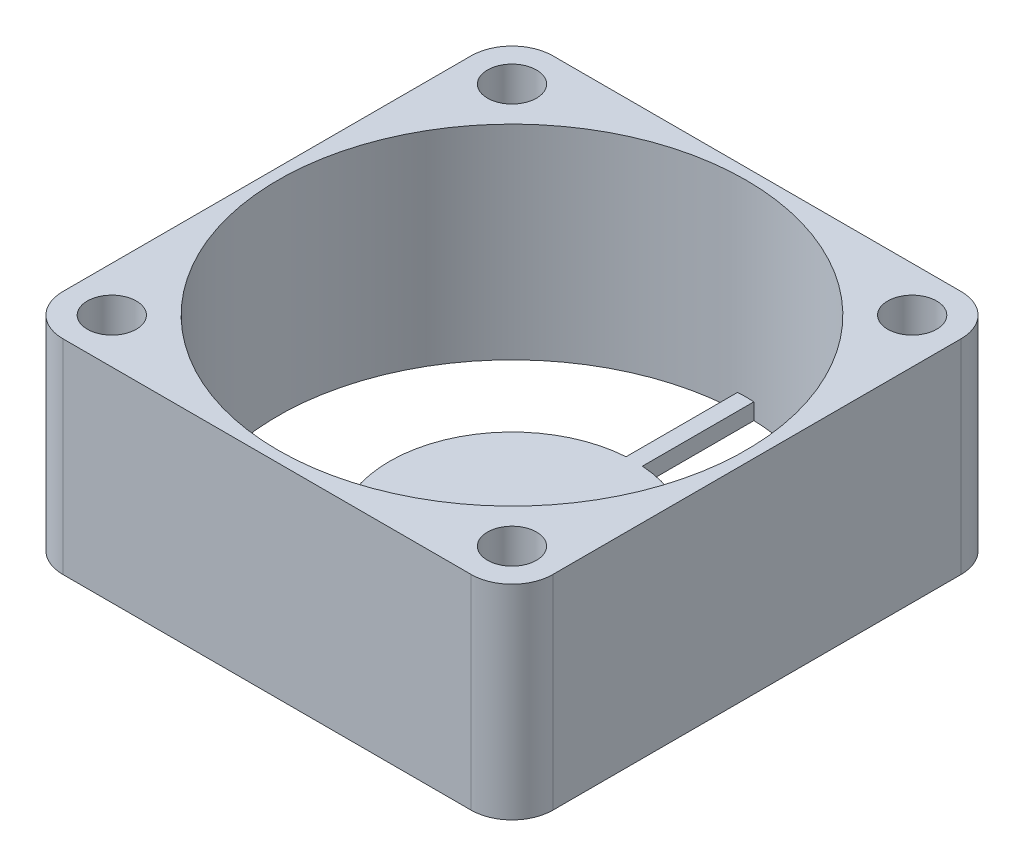
from build123d import *

# Parameters (mm, degrees)
SKETCH5_W           = 30
SKETCH5_H           = 30
SKETCH5_R           = 14.324116139
SKETCH5_R_2         = 1.5
BOSS_EXTRUDE1_DEPTH = 12.5
FILLET1_R           = 2.5
SKETCH6_R           = 7.5
BOSS_EXTRUDE2_DEPTH = 1


with BuildPart() as part:
    # Sketch5 → Boss-Extrude1 (new body)
    with BuildSketch(Plane(origin=(0, 0, 0), x_dir=(1, 0, 0), z_dir=(0, 1, 0))):
        Rectangle(SKETCH5_W, SKETCH5_H)
        with Locations(Location((0, 0, 0), (0, 0, 270))):
            Circle(SKETCH5_R, mode=Mode.SUBTRACT)
        with Locations(Location((-12.25, -12.25, 0), (0, 0, 270))):
            Circle(SKETCH5_R_2, mode=Mode.SUBTRACT)
        with Locations(Location((-12.25, 12.25, 0), (0, 0, 270))):
            Circle(SKETCH5_R_2, mode=Mode.SUBTRACT)
        with Locations(Location((12.25, -12.25, 0), (0, 0, 270))):
            Circle(SKETCH5_R_2, mode=Mode.SUBTRACT)
        with Locations(Location((12.25, 12.25, 0), (0, 0, 270))):
            Circle(SKETCH5_R_2, mode=Mode.SUBTRACT)
    extrude(amount=BOSS_EXTRUDE1_DEPTH)

    # Fillet1
    fillet1_edges = [part.edges().sort_by_distance(p)[0] for p in [
        (15, 6.25, 15),
        (-15, 6.25, 15),
        (-15, 6.25, -15),
        (15, 6.25, -15),
    ]]
    fillet(fillet1_edges, radius=FILLET1_R)


with BuildPart() as body_2:
    # Sketch6 → Boss-Extrude2 (new body)
    with BuildSketch(Plane(origin=(0, 0, 0), x_dir=(1, 0, 0), z_dir=(0, 1, 0))):
        Circle(SKETCH6_R)
        with BuildLine():
            ThreePointArc((-0.5, 7.483314774), (-0.25013916, 7.495827533), (0, 7.5))
            Line((0, 7.5), (0, 14.324116139))
            ThreePointArc((0, 14.324116139), (-0.250038097, 14.321933672), (-0.5, 14.315386937))
            Line((-0.5, 14.315386937), (-0.5, 7.483314774))
        make_face()
        with BuildLine():
            ThreePointArc((0, 7.5), (0.25013916, 7.495827533), (0.5, 7.483314774))
            Line((0.5, 7.483314774), (0.5, 14.315386937))
            ThreePointArc((0.5, 14.315386937), (0.250038097, 14.321933672), (0, 14.324116139))
            Line((0, 14.324116139), (0, 7.5))
        make_face()
        with BuildLine():
            Line((12.647488753, -6.724680767), (6.730740698, -3.308644685))
            ThreePointArc((6.730740698, -3.308644685), (6.495190528, -3.75), (6.230740698, -4.174670089))
            Line((6.230740698, -4.174670089), (12.147488753, -7.590706171))
            ThreePointArc((12.147488753, -7.590706171), (12.405048463, -7.16205807), (12.647488753, -6.724680767))
        make_face()
        with BuildLine():
            ThreePointArc((-6.230740698, -4.174670089), (-6.495190528, -3.75), (-6.730740698, -3.308644685))
            Line((-6.730740698, -3.308644685), (-12.647488753, -6.724680767))
            ThreePointArc((-12.647488753, -6.724680767), (-12.405048463, -7.16205807), (-12.147488753, -7.590706171))
            Line((-12.147488753, -7.590706171), (-6.230740698, -4.174670089))
        make_face()
    extrude(amount=BOSS_EXTRUDE2_DEPTH)


solid = Compound([part.part, body_2.part])
